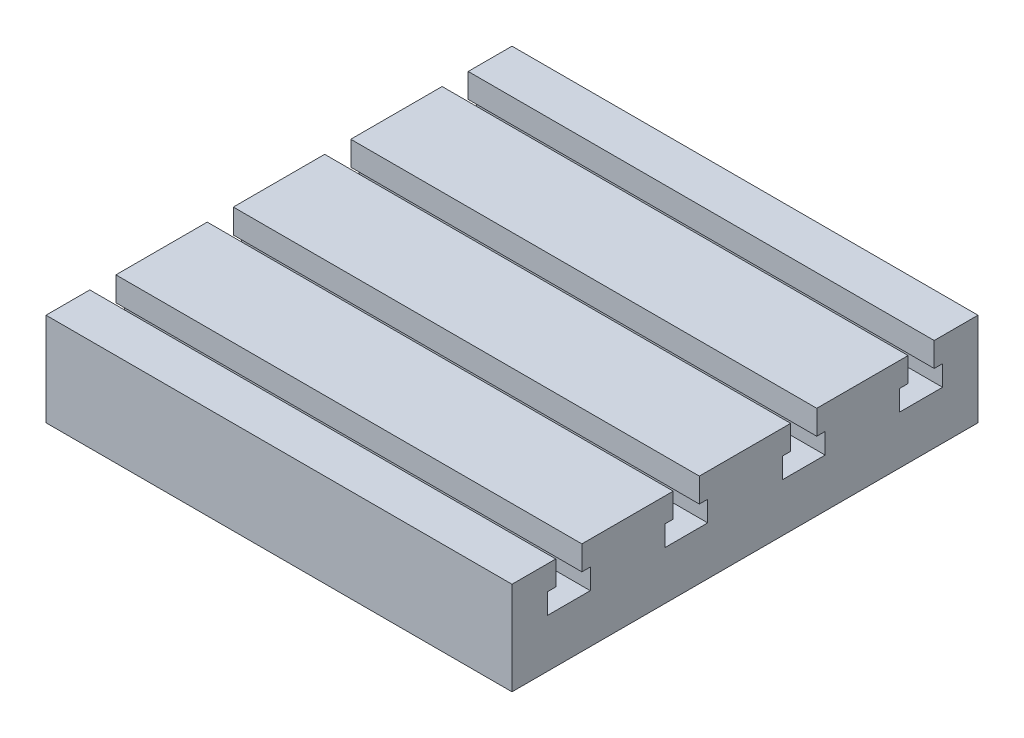
from build123d import *

# Parameters (mm, degrees)
SALIENTE_EXTRUIR1_DEPTH      = 125
SALIENTE_EXTRUIR1_DEPTH_BACK = 125
CROQUIS1_W                   = 250
CROQUIS1_H                   = 50
CORTAR_EXTRUIR1_DEPTH        = 284.94541729


with BuildPart() as part:
    # Croquis1 → Saliente-Extruir1 (new, two sides: drawn at the far end of the back side and taken through both)
    with BuildSketch(Plane(origin=(0, 0, 0), x_dir=(0, 0, -1), z_dir=(1, 0, 0)).offset(-SALIENTE_EXTRUIR1_DEPTH_BACK)):
        with Locations((0, -25)):
            Rectangle(CROQUIS1_W, CROQUIS1_H)
    extrude(amount=SALIENTE_EXTRUIR1_DEPTH + SALIENTE_EXTRUIR1_DEPTH_BACK)

    # Croquis2 → Cortar-Extruir1 (cut, through all)
    with BuildSketch(Plane(origin=(125, 0, 0), x_dir=(0, 0, -1), z_dir=(1, 0, 0))):
        Polygon((-101.5, 0), (-101.5, -13), (-106, -13), (-106, -24), (-83, -24), (-83, -13), (-87.5, -13), (-87.5, 0), align=None)
        Polygon((-24.5, 0), (-38.5, 0), (-38.5, -13), (-43, -13), (-43, -24), (-20, -24), (-20, -13), (-24.5, -13), align=None)
        Polygon((38.5, 0), (24.5, 0), (24.5, -13), (20, -13), (20, -24), (43, -24), (43, -13), (38.5, -13), align=None)
        Polygon((101.5, 0), (87.5, 0), (87.5, -13), (83, -13), (83, -24), (106, -24), (106, -13), (101.5, -13), align=None)
    extrude(amount=-CORTAR_EXTRUIR1_DEPTH, mode=Mode.SUBTRACT)


solid = part.part
